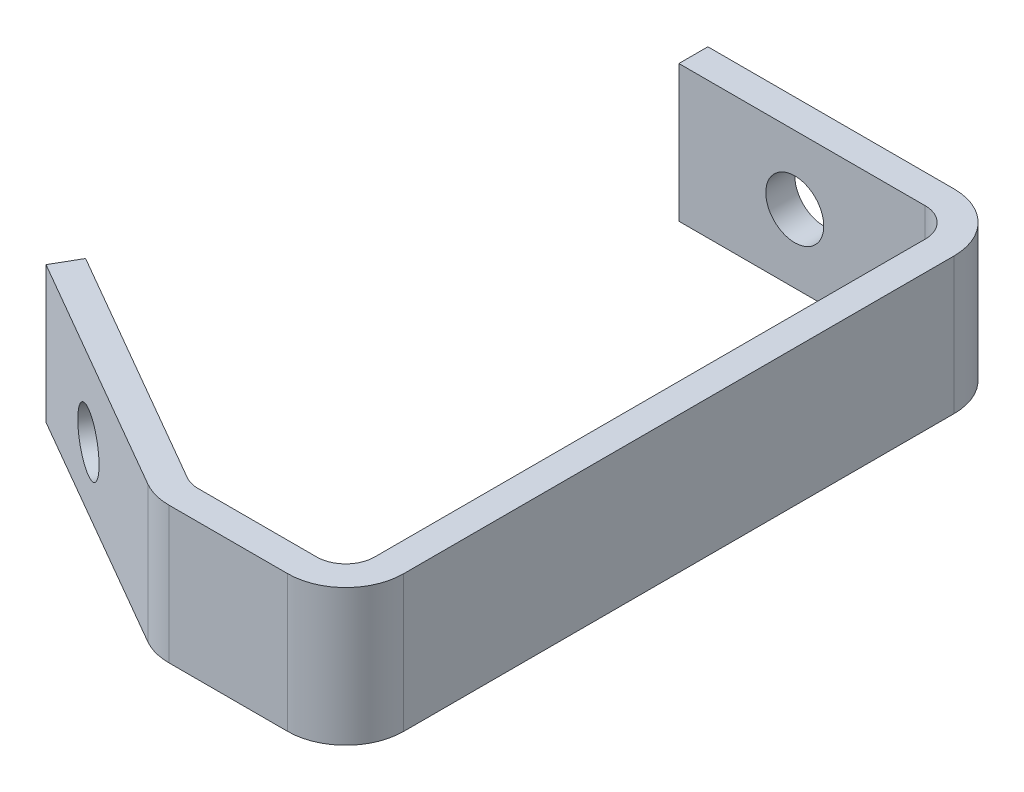
from build123d import *

# Parameters (mm, degrees)
EXTRUDE_THIN1_DEPTH = 11.787987944
FILLET1_R           = 5
FILLET2_R           = 10
FILLET3_R           = 10
FILLET4_R           = 5
FILLET5_R           = 5
FILLET6_R           = 10
SKETCH3_R           = 5
CUT_EXTRUDE1_DEPTH  = 10
SKETCH5_R           = 5
CUT_EXTRUDE2_DEPTH  = 10


with BuildPart() as part:
    # Sketch1 → Extrude-Thin1 (new, symmetric)
    with BuildSketch(Plane(origin=(0, 0, 0), x_dir=(1, 0, 0), z_dir=(0, 1, 0))):
        Polygon((-50, 107.5), (-2.5, 107.5), (-2.5, 2.5), (-29.330127019, 2.5), (-72.051270189, 27.165063509), (-74.551270189, 22.834936491), (-30.669872981, -2.5), (2.5, -2.5), (2.5, 112.5), (-50, 112.5), align=None)
    extrude(amount=EXTRUDE_THIN1_DEPTH, both=True)

    # Fillet1
    fillet1_edges = [part.edges().sort_by_distance(p)[0] for p in [
        (-2.5, 0, -107.5),
    ]]
    fillet(fillet1_edges, radius=FILLET1_R)

    # Fillet2
    fillet2_edges = [part.edges().sort_by_distance(p)[0] for p in [
        (2.5, 0, -112.5),
    ]]
    fillet(fillet2_edges, radius=FILLET2_R)

    # Fillet3
    fillet3_edges = [part.edges().sort_by_distance(p)[0] for p in [
        (2.5, 0, 2.5),
    ]]
    fillet(fillet3_edges, radius=FILLET3_R)

    # Fillet4
    fillet4_edges = [part.edges().sort_by_distance(p)[0] for p in [
        (-2.5, 0, -2.5),
    ]]
    fillet(fillet4_edges, radius=FILLET4_R)

    # Fillet5
    fillet5_edges = [part.edges().sort_by_distance(p)[0] for p in [
        (-29.330127019, 0, -2.5),
    ]]
    fillet(fillet5_edges, radius=FILLET5_R)

    # Fillet6
    fillet6_edges = [part.edges().sort_by_distance(p)[0] for p in [
        (-30.669872981, 0, 2.5),
    ]]
    fillet(fillet6_edges, radius=FILLET6_R)

    # Sketch3 → Cut-Extrude1 (cut)
    with BuildSketch(Plane(origin=(0, 0, -112.5), x_dir=(-1, 0, 0), z_dir=(0, 0, -1))):
        with Locations((30, 0)):
            Circle(SKETCH3_R)
    extrude(amount=-CUT_EXTRUDE1_DEPTH, mode=Mode.SUBTRACT)

    # Sketch5 → Cut-Extrude2 (cut)
    with BuildSketch(Plane(origin=(-8.75, 0, 15.155444566), x_dir=(0.866025403784438, 0, 0.500000000000001), z_dir=(-0.500000000000001, 0, 0.866025403784438))):
        with Locations((-55.980762114, -1.07656789)):
            Circle(SKETCH5_R)
    extrude(amount=-CUT_EXTRUDE2_DEPTH, mode=Mode.SUBTRACT)


solid = part.part
